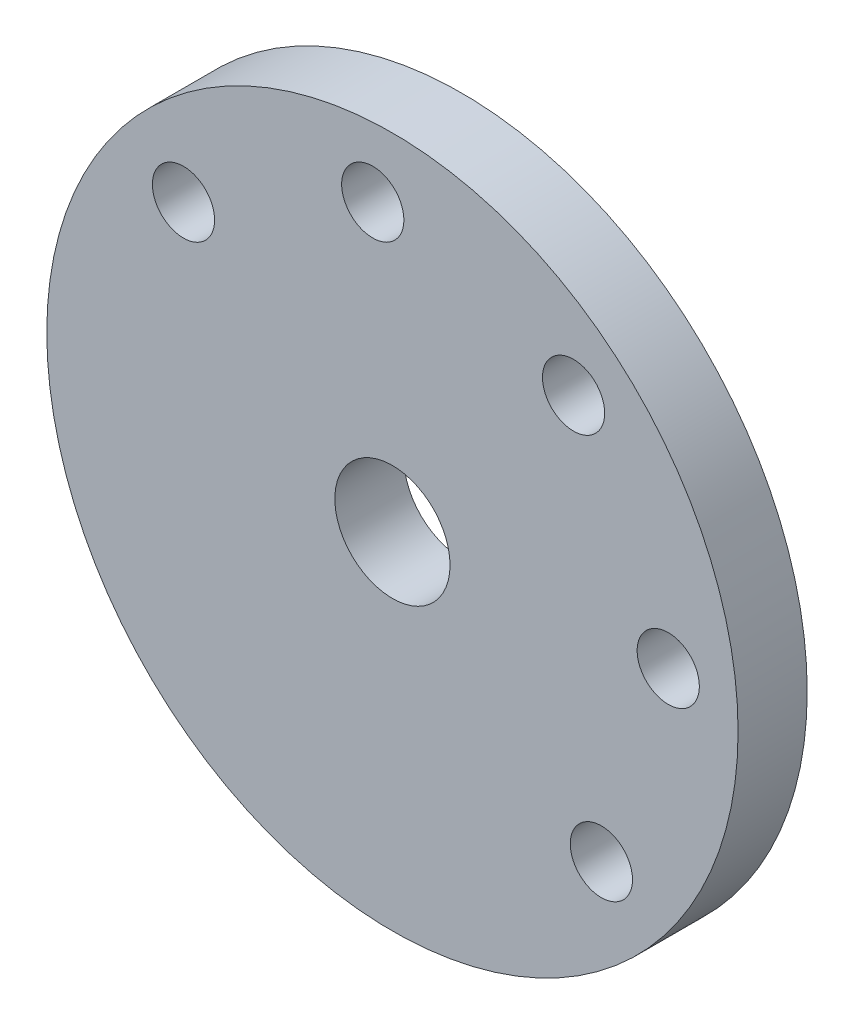
from build123d import *

# Parameters (mm, degrees)
SKETCH_1_R      = 15
SKETCH_1_R_2    = 1.35
SKETCH_1_R_3    = 2.5
EXTRUDE_1_DEPTH = 3


with BuildPart() as part:
    # 草图1 → 凸台-拉伸1 (new body)
    with BuildSketch(Plane.XY):
        with Locations((125, 0)):
            Circle(SKETCH_1_R)
        with Locations((132.860147625, 9.067418558)):
            Circle(SKETCH_1_R_2, mode=Mode.SUBTRACT)
        with Locations((136.969596837, 0.853669463)):
            Circle(SKETCH_1_R_2, mode=Mode.SUBTRACT)
        with Locations((134.067418558, -7.860147625)):
            Circle(SKETCH_1_R_2, mode=Mode.SUBTRACT)
        with Locations((124.146330537, 11.969596837)):
            Circle(SKETCH_1_R_2, mode=Mode.SUBTRACT)
        with Locations((115.932581442, 7.860147625)):
            Circle(SKETCH_1_R_2, mode=Mode.SUBTRACT)
        with Locations((125, 0)):
            Circle(SKETCH_1_R_3, mode=Mode.SUBTRACT)
    extrude(amount=EXTRUDE_1_DEPTH)


solid = part.part
